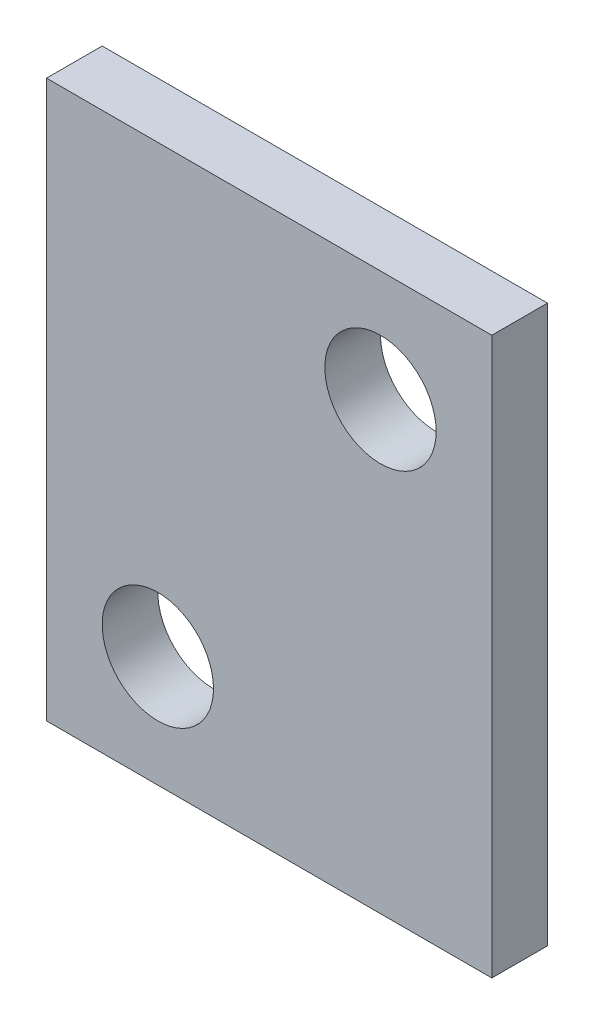
from build123d import *

# Parameters (mm, degrees)
ESQUISSE1_W      = 12
ESQUISSE1_H      = 15
ESQUISSE1_R      = 1.5
EXTRUSION1_DEPTH = 1.5


with BuildPart() as part:
    # Esquisse1 → Extrusion1 (new body)
    with BuildSketch(Plane.XY):
        with Locations((-9.520602372, 2.796546227)):
            Rectangle(ESQUISSE1_W, ESQUISSE1_H)
        with Locations((-6.520602372, 7.296546227)):
            Circle(ESQUISSE1_R, mode=Mode.SUBTRACT)
        with Locations((-12.520602372, -1.703453773)):
            Circle(ESQUISSE1_R, mode=Mode.SUBTRACT)
    extrude(amount=EXTRUSION1_DEPTH)


solid = part.part
